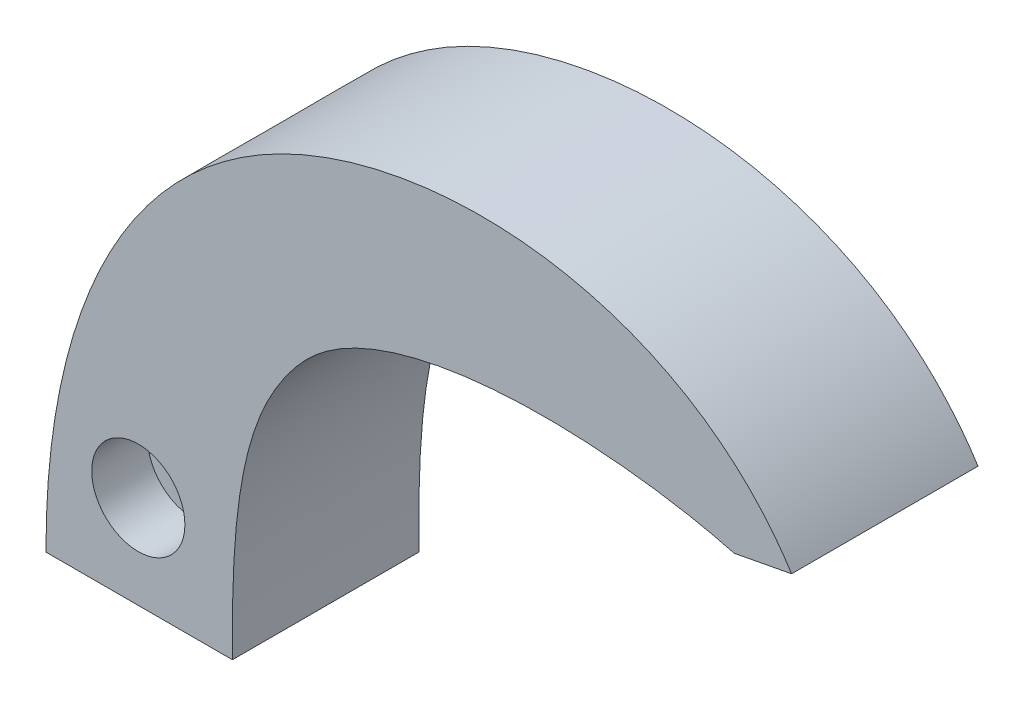
from build123d import *

# Parameters (mm, degrees)
BOSS_EXTRU_1_DEPTH           = 10
ESQUISSE2_R                  = 1.5
ENL_V_MAT_EXTRU_1_DEPTH      = 10
ESQUISSE3_R                  = 2.5
ENL_V_MAT_EXTRU_2_DEPTH      = 3
ENL_V_START                  = -3
ESQUISSE4_R                  = 2.5
ENL_V_MAT_EXTRU_3_DEPTH      = 3
ENL_V_MAT_EXTRU_5_DEPTH      = 50.448460785
ENL_V_MAT_EXTRU_5_DEPTH_BACK = 10


with BuildPart() as part:
    # Esquisse1 → Boss.-Extru.1 (new body)
    with BuildSketch(Plane.XY):
        with BuildLine():
            Line((0, 0), (10, 0))
            add(Edge.make_bspline(
                [(10, 0), (9.921489326, 7.148546847), (10.713934518, 12.333283688), (18.75869357, 21.376035051), (34.363019417, 19.898437833), (40, 17.351511011)],
                knots=[0, 0, 0, 0, 0.337628769, 0.409350915, 1, 1, 1, 1], degree=3))
            Line((40, 17.351511011), (40, 18.993822565))
            add(Edge.make_bspline(
                [(0, 0), (-0.039213766, 11.180464065), (8.69921101, 30.121953716), (34.057263146, 28.337308065), (40, 18.993822565)],
                knots=[0, 0, 0, 0, 0.468371503, 1, 1, 1, 1], degree=3))
        make_face()
    extrude(amount=BOSS_EXTRU_1_DEPTH)

    # Esquisse2 → Enlèv. mat.-Extru.1 (cut)
    with BuildSketch(Plane.XY.offset(10)):
        with Locations((4.95185359, 5)):
            Circle(ESQUISSE2_R)
    extrude(amount=-ENL_V_MAT_EXTRU_1_DEPTH, mode=Mode.SUBTRACT)

    # Esquisse3 → Enlèv. mat.-Extru.2 (cut)
    with BuildSketch(Plane.XY.offset(10)):
        with Locations((4.95185359, 5)):
            Circle(ESQUISSE3_R)
    extrude(amount=-ENL_V_MAT_EXTRU_2_DEPTH, mode=Mode.SUBTRACT)

    # Esquisse4 → Enlèv. mat.-Extru.3 (cut)
    with BuildSketch(Plane(origin=(0, 0, 0), x_dir=(-1, 0, 0), z_dir=(0, 0, -1)).offset(ENL_V_START)):
        with Locations(Location((-4.95185359, 5, 0), (0, 0, 180))):
            Circle(ESQUISSE4_R)
    extrude(amount=ENL_V_MAT_EXTRU_3_DEPTH, mode=Mode.SUBTRACT)

    # Esquisse5 → Enlèv. mat.-Extru.5 (cut, two sides: drawn at the far end of the back side and taken through both)
    with BuildSketch(Plane.XY.offset(10).offset(-ENL_V_MAT_EXTRU_5_DEPTH_BACK)):
        with BuildLine():
            Line((40, 17.351511011), (40, 18.993822565))
            Line((40, 18.993822565), (36.925358186, 18.408031117))
            add(Edge.make_bspline(
                [(36.925358186, 18.408031117), (38.102088932, 18.094984676), (39.146032524, 17.737354573), (40, 17.351511011)],
                knots=[0.91052034, 0.91052034, 0.91052034, 0.91052034, 1, 1, 1, 1], degree=3))
        make_face()
    extrude(amount=ENL_V_MAT_EXTRU_5_DEPTH + ENL_V_MAT_EXTRU_5_DEPTH_BACK, mode=Mode.SUBTRACT)


solid = part.part
